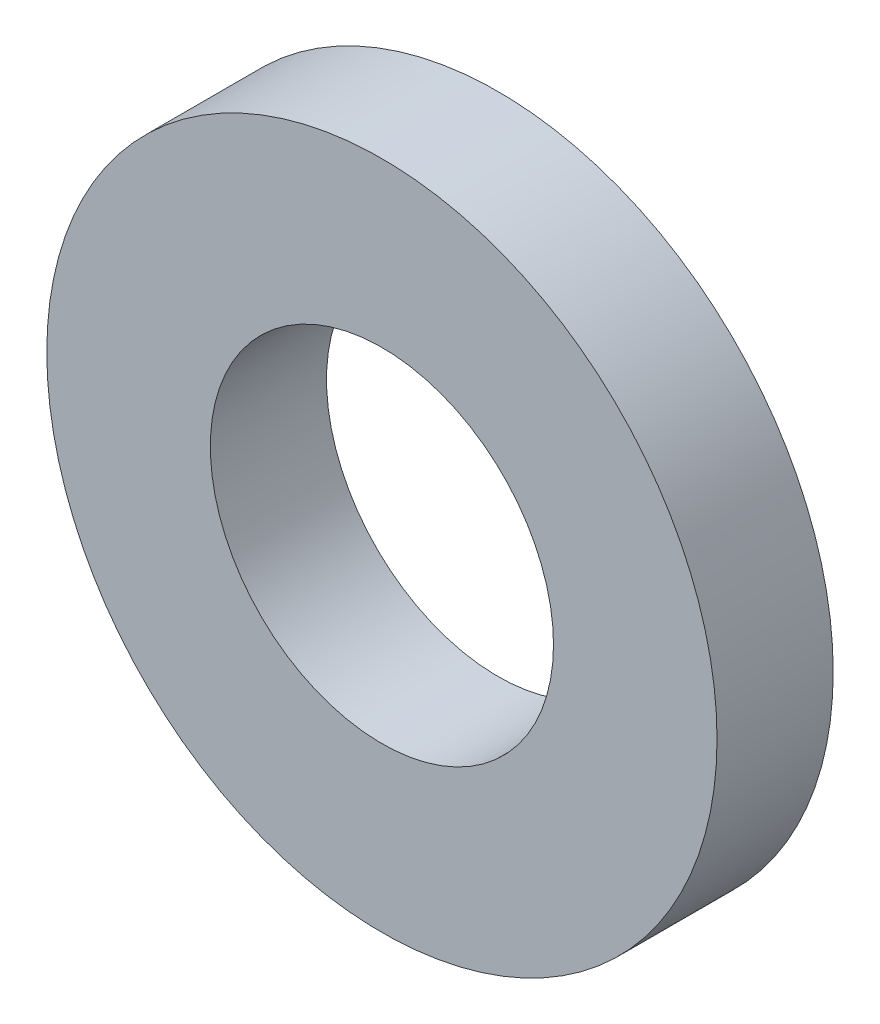
from build123d import *

# Parameters (mm, degrees)
SKETCH1_R      = 4.7625
SKETCH1_R_2    = 2.4384
EXTRUDE1_DEPTH = 1.651


with BuildPart() as part:
    # Sketch1 → Extrude1 (new body)
    with BuildSketch(Plane.XY):
        Circle(SKETCH1_R)
        Circle(SKETCH1_R_2, mode=Mode.SUBTRACT)
    extrude(amount=-EXTRUDE1_DEPTH)


solid = part.part
